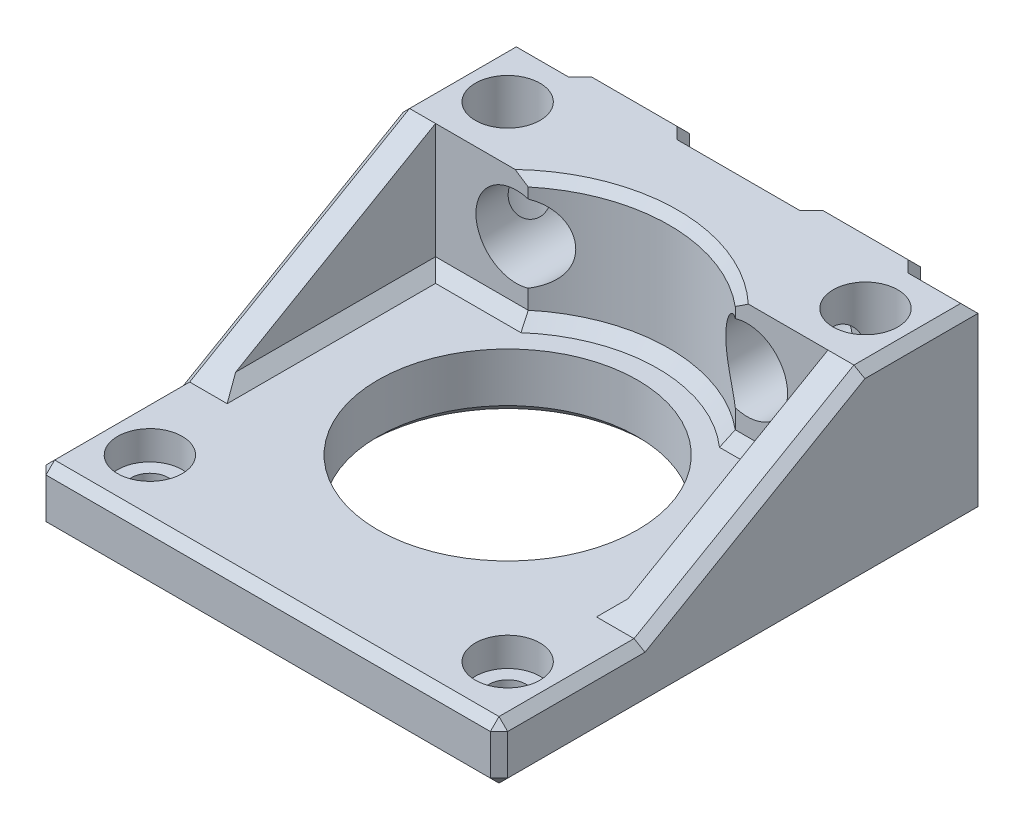
from build123d import *

# Parameters (mm, degrees)
SKETCH1_R           = 11.25
SKETCH1_R_2         = 1.6
BOSS_EXTRUDE1_DEPTH = 5
SKETCH4_R           = 2.8
CUT_EXTRUDE1_DEPTH  = 2.5
BOSS_EXTRUDE2_START = 11
SKETCH2_R           = 2.8
BOSS_EXTRUDE2_DEPTH = 11
BOSS_EXTRUDE3_DEPTH = 3
CHAMFER2_SIZE       = 1
CUT_EXTRUDE2_REACH  = 42.599
SKETCH5_R           = 2.1
SKETCH6_R           = 3.5
CUT_EXTRUDE3_DEPTH  = 7
CHAMFER3_SIZE       = 0.75


with BuildPart() as part:
    # Sketch1 → Boss-Extrude1 (new body)
    with BuildSketch(Plane(origin=(0, 0, 0), x_dir=(1, 0, 0), z_dir=(0, 1, 0))):
        Polygon((-20, 20.75), (-15, 20.75), (-14, 21.75), (-6, 21.75), (-5, 20.75), (5, 20.75), (6, 21.75), (14, 21.75), (15, 20.75), (20, 20.75), (20, -20.75), (-20, -20.75), align=None)
        with Locations(Location((0, 0, 0), (0, 0, 270))):
            Circle(SKETCH1_R, mode=Mode.SUBTRACT)
        with Locations(Location((15.5, 15.5, 0), (0, 0, 270))):
            Circle(SKETCH1_R_2, mode=Mode.SUBTRACT)
        with Locations(Location((-15.5, 15.5, 0), (0, 0, 270))):
            Circle(SKETCH1_R_2, mode=Mode.SUBTRACT)
        with Locations(Location((-15.5, -15.5, 0), (0, 0, 270))):
            Circle(SKETCH1_R_2, mode=Mode.SUBTRACT)
        with Locations(Location((15.5, -15.5, 0), (0, 0, 270))):
            Circle(SKETCH1_R_2, mode=Mode.SUBTRACT)
    extrude(amount=BOSS_EXTRUDE1_DEPTH)

    # Sketch4 → Cut-Extrude1 (cut)
    with BuildSketch(Plane(origin=(0, 5, 0), x_dir=(1, 0, 0), z_dir=(0, 1, 0))):
        with Locations(Location((-15.5, -15.5, 0), (0, 0, 270))):
            Circle(SKETCH4_R)
        with Locations(Location((15.5, 15.5, 0), (0, 0, 270))):
            Circle(SKETCH4_R)
        with Locations(Location((-15.5, 15.5, 0), (0, 0, 270))):
            Circle(SKETCH4_R)
        with Locations(Location((15.5, -15.5, 0), (0, 0, 270))):
            Circle(SKETCH4_R)
    extrude(amount=-CUT_EXTRUDE1_DEPTH, mode=Mode.SUBTRACT)

    # Sketch2 → Boss-Extrude2 (add)
    with BuildSketch(Plane(origin=(0, 5, 0), x_dir=(1, 0, 0), z_dir=(0, 1, 0)).offset(BOSS_EXTRUDE2_START)):
        with BuildLine():
            Line((-20, 10.75), (-8.968695557, 10.75))
            ThreePointArc((-8.968695557, 10.75), (0, 14), (8.968695557, 10.75))
            Line((8.968695557, 10.75), (20, 10.75))
            Line((20, 10.75), (20, 20.75))
            Line((20, 20.75), (15, 20.75))
            Line((15, 20.75), (14, 21.75))
            Line((14, 21.75), (6, 21.75))
            Line((6, 21.75), (5, 20.75))
            Line((5, 20.75), (-5, 20.75))
            Line((-5, 20.75), (-6, 21.75))
            Line((-6, 21.75), (-14, 21.75))
            Line((-14, 21.75), (-15, 20.75))
            Line((-15, 20.75), (-20, 20.75))
            Line((-20, 20.75), (-20, 10.75))
        make_face()
        with Locations((-15.5, 15.5)):
            Circle(SKETCH2_R, mode=Mode.SUBTRACT)
        with Locations((15.5, 15.5)):
            Circle(SKETCH2_R, mode=Mode.SUBTRACT)
    extrude(amount=-BOSS_EXTRUDE2_DEPTH)

    # Sketch3 → Boss-Extrude3 (add)
    with BuildSketch(Plane(origin=(20, 0, 0), x_dir=(0, 0, -1), z_dir=(1, 0, 0))):
        Polygon((10.75, 16), (-8.302558883, 5), (10.75, 5), align=None)
    boss_extrude3 = extrude(amount=-BOSS_EXTRUDE3_DEPTH)

    # Mirror1: Boss-Extrude3 across plane
    add(boss_extrude3.mirror(Plane(origin=(0, 0, 0), x_dir=(0, 0, 1), z_dir=(1, 0, 0))))

    # Chamfer2
    chamfer2_edges = [part.edges().sort_by_distance(p)[0] for p in [
        (12.984347779, 5, -10.75),
        (17, 5, -1.223720558),
        (-17, 5, -1.223720558),
        (0, 5, -14),
        (-12.984347779, 5, -10.75),
    ]]
    chamfer(chamfer2_edges, length=CHAMFER2_SIZE)

    # Sketch5 → Cut-Extrude2 (cut, up to next)
    with BuildSketch(Plane.XY.offset(-10.75), mode=Mode.PRIVATE) as cut_extrude2_sk1:
        with Locations((-10, 11)):
            Circle(SKETCH5_R)
    cut_extrude2_tool1 = extrude(cut_extrude2_sk1.sketch, amount=-CUT_EXTRUDE2_REACH, mode=Mode.PRIVATE) & part.part
    # Sketch5 → Cut-Extrude2 (cut, up to next)
    with BuildSketch(Plane.XY.offset(-10.75), mode=Mode.PRIVATE) as cut_extrude2_sk2:
        with Locations((10, 11)):
            Circle(SKETCH5_R)
    cut_extrude2_tool2 = extrude(cut_extrude2_sk2.sketch, amount=-CUT_EXTRUDE2_REACH, mode=Mode.PRIVATE) & part.part
    add(cut_extrude2_tool1.solids().sort_by_distance((-10, 11, -10.75))[0], mode=Mode.SUBTRACT)
    add(cut_extrude2_tool2.solids().sort_by_distance((10, 11, -10.75))[0], mode=Mode.SUBTRACT)

    # Sketch6 → Cut-Extrude3 (cut)
    with BuildSketch(Plane.XY.offset(-10.75)):
        with Locations((-10, 11)):
            Circle(SKETCH6_R)
        with Locations((10, 11)):
            Circle(SKETCH6_R)
    extrude(amount=-CUT_EXTRUDE3_DEPTH, mode=Mode.SUBTRACT)

    # Chamfer3
    chamfer3_edges = [part.edges().sort_by_distance(p)[0] for p in [
        (-17.5, 0, -20.75),
        (-14.5, 0, -21.25),
        (20, 5, 14.526279442),
        (-10, 0, -21.75),
        (20, 10.5, -1.223720558),
        (-5.5, 0, -21.25),
        (0, 0, -20.75),
        (-20, 5, 14.526279442),
        (-20, 10.5, -1.223720558),
        (5.5, 0, -21.25),
        (10, 0, -21.75),
        (14.5, 0, -21.25),
        (17.5, 0, -20.75),
        (20, 0, 0),
        (0, 0, 20.75),
        (-20, 0, 0),
        (20, 2.5, 20.75),
        (-20, 2.5, 20.75),
        (0, 0, -11.25),
        (15.5, 0, -17.1),
        (-15.5, 0, -17.1),
        (-15.5, 0, 13.9),
        (15.5, 0, 13.9),
        (0, 5, 20.75),
        (0, 16, -14),
        (20, 16, -15.75),
        (17.5, 16, -20.75),
        (14.5, 16, -21.25),
        (10, 16, -21.75),
        (5.5, 16, -21.25),
        (0, 16, -20.75),
        (-5.5, 16, -21.25),
        (-10, 16, -21.75),
        (-14.5, 16, -21.25),
        (-17.5, 16, -20.75),
        (-20, 16, -15.75),
    ]]
    chamfer(chamfer3_edges, length=CHAMFER3_SIZE)


solid = part.part
